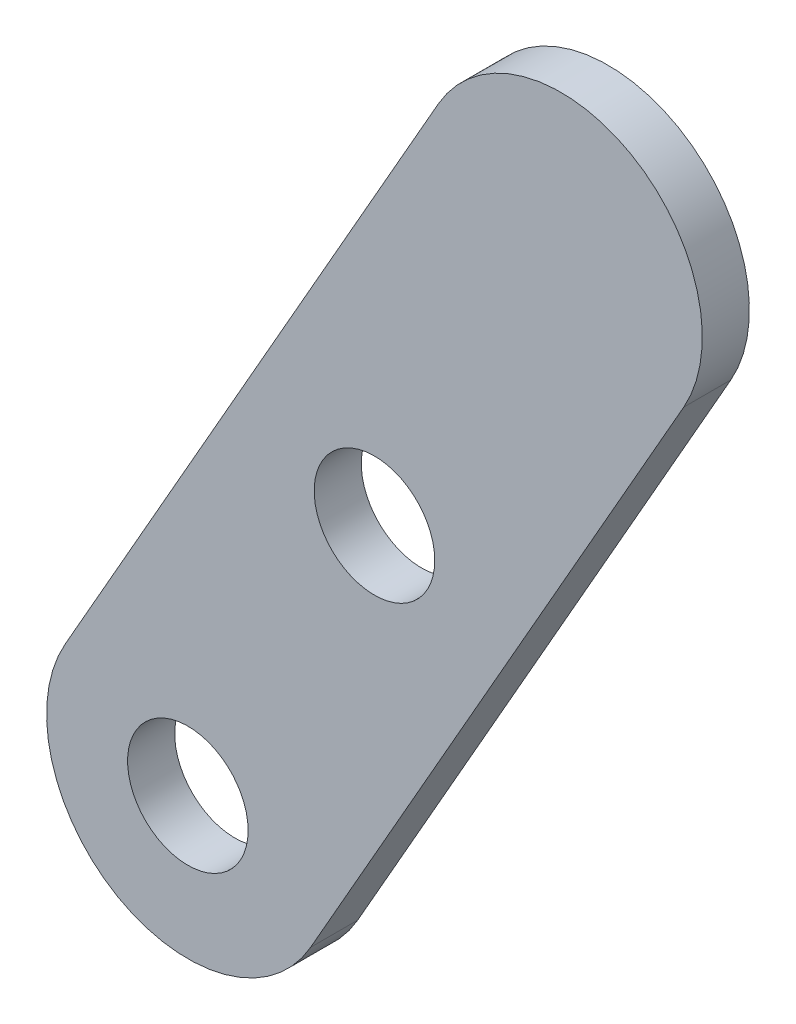
from build123d import *

# Parameters (mm, degrees)
SKETCH1_R           = 2.032
BOSS_EXTRUDE1_DEPTH = 1.5875


with BuildPart() as part:
    # Sketch1 → Boss-Extrude1 (new body)
    with BuildSketch(Plane.XY):
        with BuildLine():
            Line((-4.137168894, 2.359076046), (8.444570016, 24.423976816))
            ThreePointArc((8.444570016, 24.423976816), (14.940814956, 26.202069665), (16.718907805, 19.705824725))
            Line((16.718907805, 19.705824725), (4.137168894, -2.359076046))
            ThreePointArc((4.137168894, -2.359076046), (-2.359076046, -4.137168894), (-4.137168894, 2.359076046))
        make_face()
        Circle(SKETCH1_R, mode=Mode.SUBTRACT)
        with Locations((6.290869455, 11.032450385)):
            Circle(SKETCH1_R, mode=Mode.SUBTRACT)
    extrude(amount=BOSS_EXTRUDE1_DEPTH)


solid = part.part
